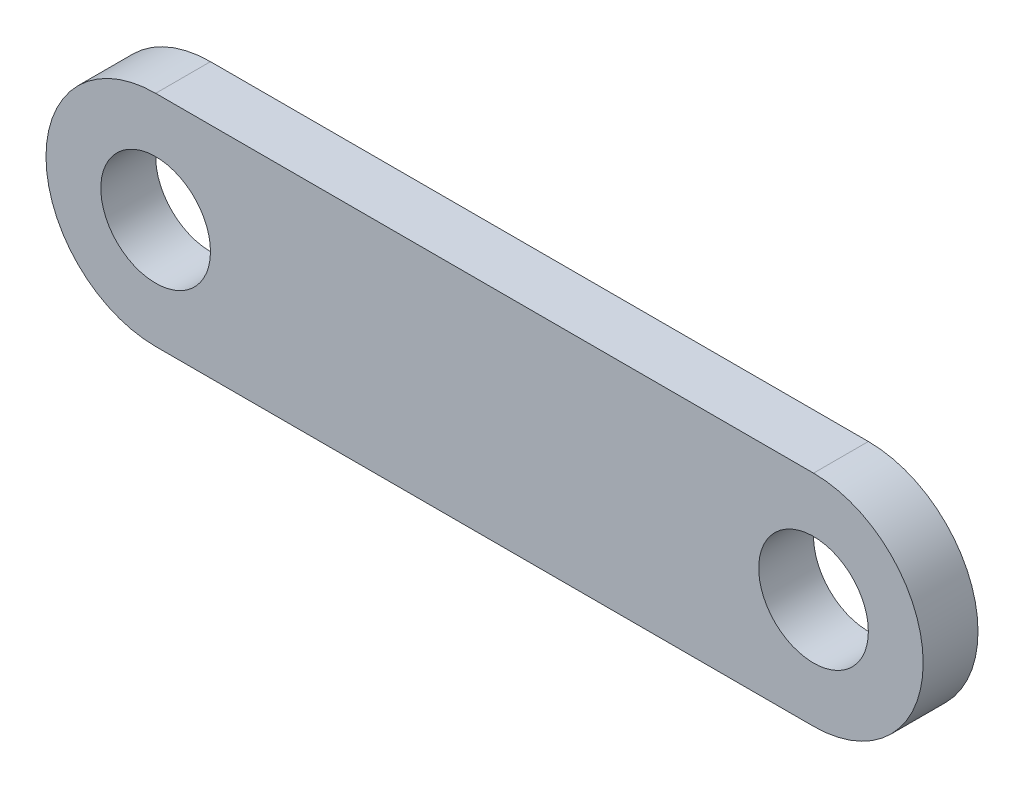
from build123d import *

# Parameters (mm, degrees)
SKETCH_1_R      = 10
EXTRUDE_1_DEPTH = 10


with BuildPart() as part:
    # 草图1 → 凸台-拉伸1 (new body)
    with BuildSketch(Plane.XY):
        with BuildLine():
            Line((-47.207779672, 30.872865574), (72.792220328, 30.872865574))
            ThreePointArc((72.792220328, 30.872865574), (92.792220328, 10.872865574), (72.792220328, -9.127134426))
            Line((72.792220328, -9.127134426), (-47.207779672, -9.127134426))
            ThreePointArc((-47.207779672, -9.127134426), (-67.207779672, 10.872865574), (-47.207779672, 30.872865574))
        make_face()
        with Locations((72.792220328, 10.872865574)):
            Circle(SKETCH_1_R, mode=Mode.SUBTRACT)
        with Locations((-47.207779672, 10.872865574)):
            Circle(SKETCH_1_R, mode=Mode.SUBTRACT)
    extrude(amount=EXTRUDE_1_DEPTH)


solid = part.part
